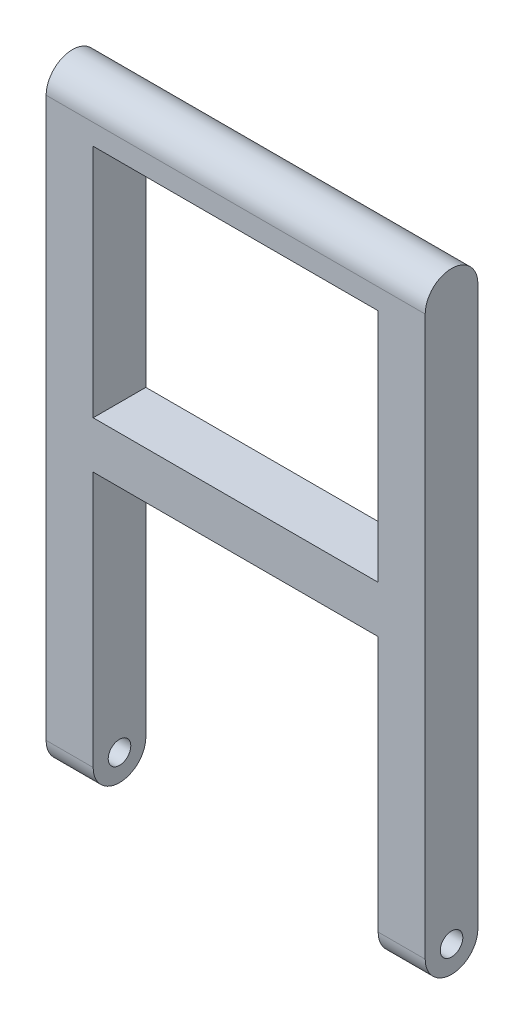
from build123d import *

# Parameters (mm, degrees)
SKICA1_W                 = 30.3
SKICA1_H                 = 5
P_IDAT_VYSUNUT_M1_DEPTH  = 5.6
SKICA2_R                 = 1.2
ODEBRAT_VYSUNUT_M1_DEPTH = 77.684092223
ODEBRAT_VYSUNUT_M3_DEPTH = 77.684092223


with BuildPart() as part:
    # Skica1 → Přidat vysunutím1 (new body)
    with BuildSketch(Plane.XY):
        Polygon((5, 0), (0, 0), (0, 65), (40.3, 65), (40.3, 0), (35.3, 0), (35.3, 60), (5, 60), align=None)
        with Locations((20.15, 32.5)):
            Rectangle(SKICA1_W, SKICA1_H)
    extrude(amount=P_IDAT_VYSUNUT_M1_DEPTH)

    # Skica2 → Odebrat vysunutím1 (cut, through all)
    with BuildSketch(Plane.ZY):
        with BuildLine():
            Line((5.6, 0), (5.6, 2.8))
            ThreePointArc((5.6, 2.8), (4.779898987, 0.820101013), (2.8, 0))
            Line((2.8, 0), (5.6, 0))
        make_face()
        with BuildLine():
            ThreePointArc((2.8, 0), (0.820101013, 0.820101013), (0, 2.8))
            Line((0, 2.8), (0, 0))
            Line((0, 0), (2.8, 0))
        make_face()
        with Locations((2.8, 2.8)):
            Circle(SKICA2_R)
    extrude(amount=-ODEBRAT_VYSUNUT_M1_DEPTH, mode=Mode.SUBTRACT)

    # Skica3 → Odebrat vysunutím3 (cut, through all)
    with BuildSketch(Plane.ZY):
        with BuildLine():
            Line((0, 65), (0, 62.2))
            ThreePointArc((0, 62.2), (0.820101013, 64.179898987), (2.8, 65))
            Line((2.8, 65), (0, 65))
        make_face()
        with BuildLine():
            ThreePointArc((2.8, 65), (4.779898987, 64.179898987), (5.6, 62.2))
            Line((5.6, 62.2), (5.6, 65))
            Line((5.6, 65), (2.8, 65))
        make_face()
    extrude(amount=-ODEBRAT_VYSUNUT_M3_DEPTH, mode=Mode.SUBTRACT)


solid = part.part
